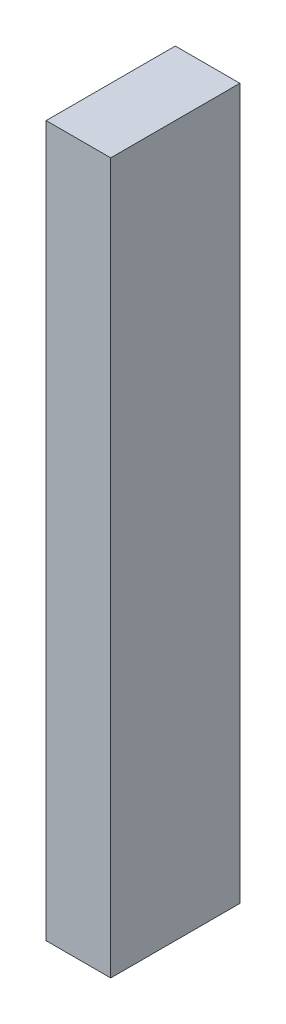
from build123d import *

# Parameters (mm, degrees)
SKETCH1_W           = 50.8
SKETCH1_H           = 101.6
BOSS_EXTRUDE1_DEPTH = 558.8


with BuildPart() as part:
    # Sketch1 → Boss-Extrude1 (new body)
    with BuildSketch(Plane(origin=(0, 0, 0), x_dir=(1, 0, 0), z_dir=(0, 1, 0))):
        with Locations((25.4, 50.8)):
            Rectangle(SKETCH1_W, SKETCH1_H)
    extrude(amount=BOSS_EXTRUDE1_DEPTH)


solid = part.part
